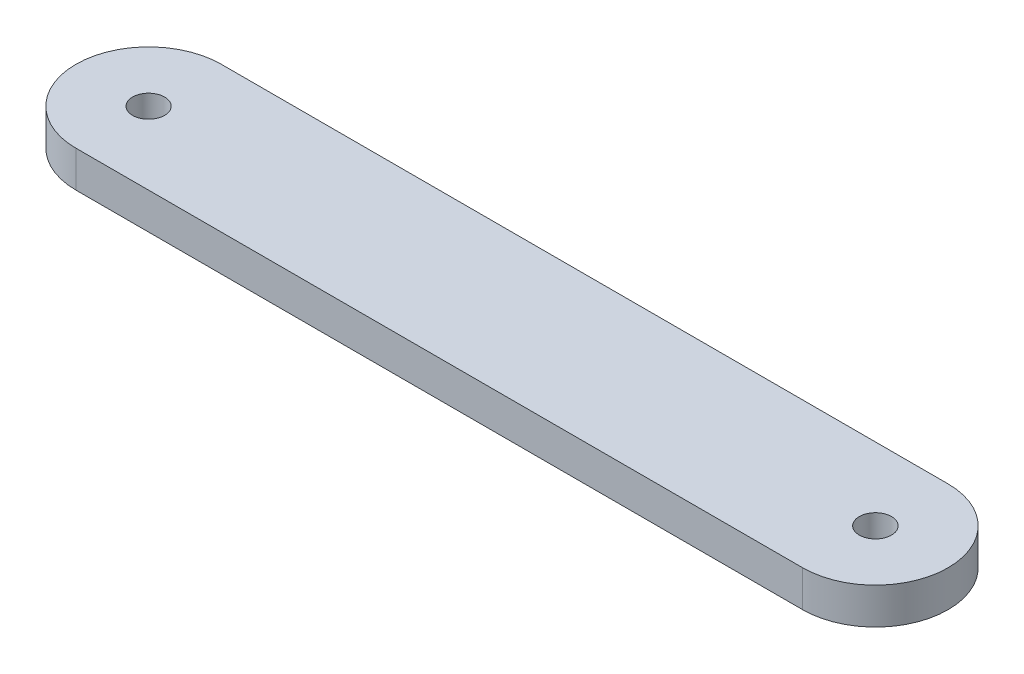
from build123d import *

# Parameters (mm, degrees)
SKETCH1_R           = 2.794
SKETCH1_R_2         = 2.813515076
BOSS_EXTRUDE1_DEPTH = 6.35


with BuildPart() as part:
    # Sketch1 → Boss-Extrude1 (new body)
    with BuildSketch(Plane(origin=(0, 0, 0), x_dir=(1, 0, 0), z_dir=(0, 1, 0))):
        with BuildLine():
            Line((0, 12.7), (127, 12.7))
            ThreePointArc((127, 12.7), (139.7, 0), (127, -12.7))
            Line((127, -12.7), (0, -12.7))
            ThreePointArc((0, -12.7), (-12.7, 0), (0, 12.7))
        make_face()
        with Locations(Location((0, 0, 0), (0, 0, 270))):
            Circle(SKETCH1_R, mode=Mode.SUBTRACT)
        with Locations(Location((127, 0, 0), (0, 0, 270))):
            Circle(SKETCH1_R_2, mode=Mode.SUBTRACT)
    extrude(amount=BOSS_EXTRUDE1_DEPTH)


solid = part.part
